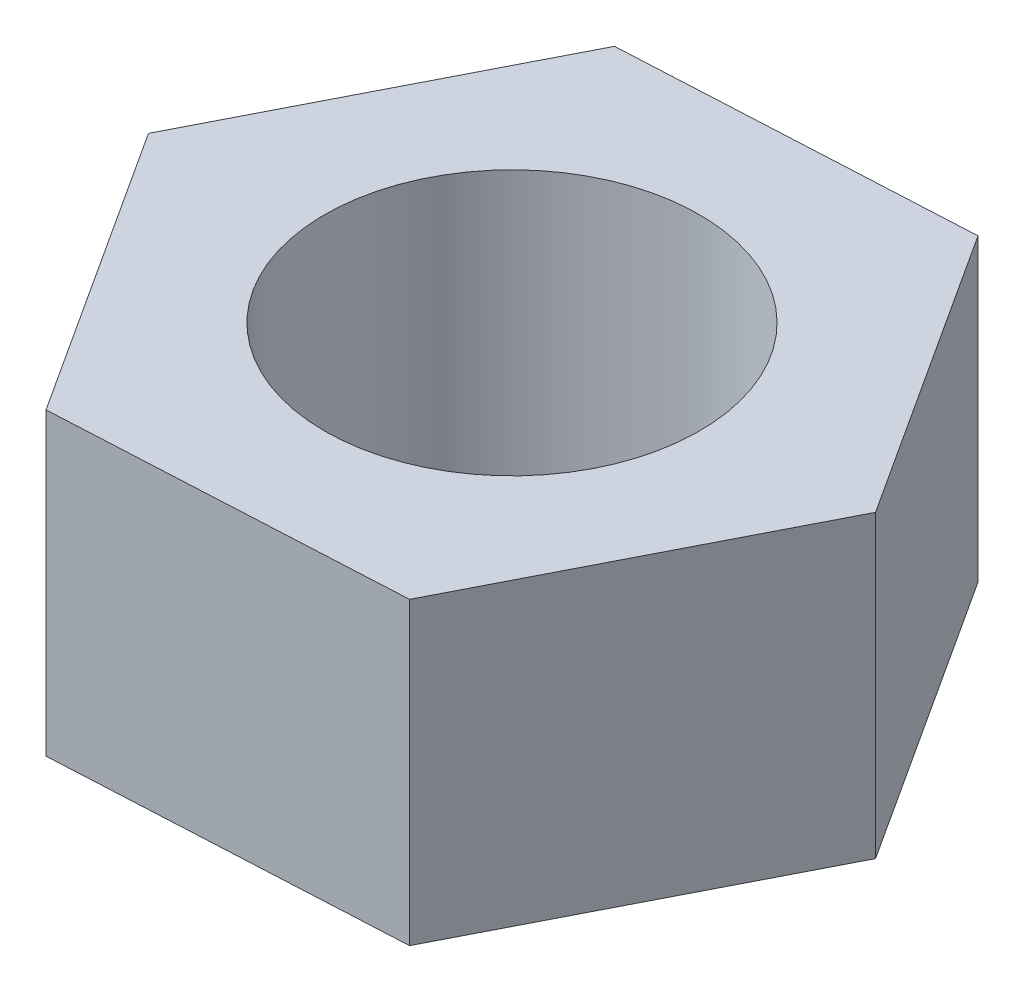
from build123d import *

# Parameters (mm, degrees)
SKETCH1_R           = 6.35
BOSS_EXTRUDE1_DEPTH = 10.16


with BuildPart() as part:
    # Sketch1 → Boss-Extrude1 (new body)
    with BuildSketch(Plane(origin=(0, 0, 0), x_dir=(1, 0, 0), z_dir=(0, 1, 0))):
        Polygon((6.376634901, -9.84746976), (11.716476426, 0.598592935), (5.339841525, 10.446062695), (-6.376634901, 9.84746976), (-11.716476426, -0.598592935), (-5.339841525, -10.446062695), align=None)
        with Locations(Location((0, 0, 0), (0, 0, 270))):
            Circle(SKETCH1_R, mode=Mode.SUBTRACT)
    extrude(amount=BOSS_EXTRUDE1_DEPTH)


solid = part.part
